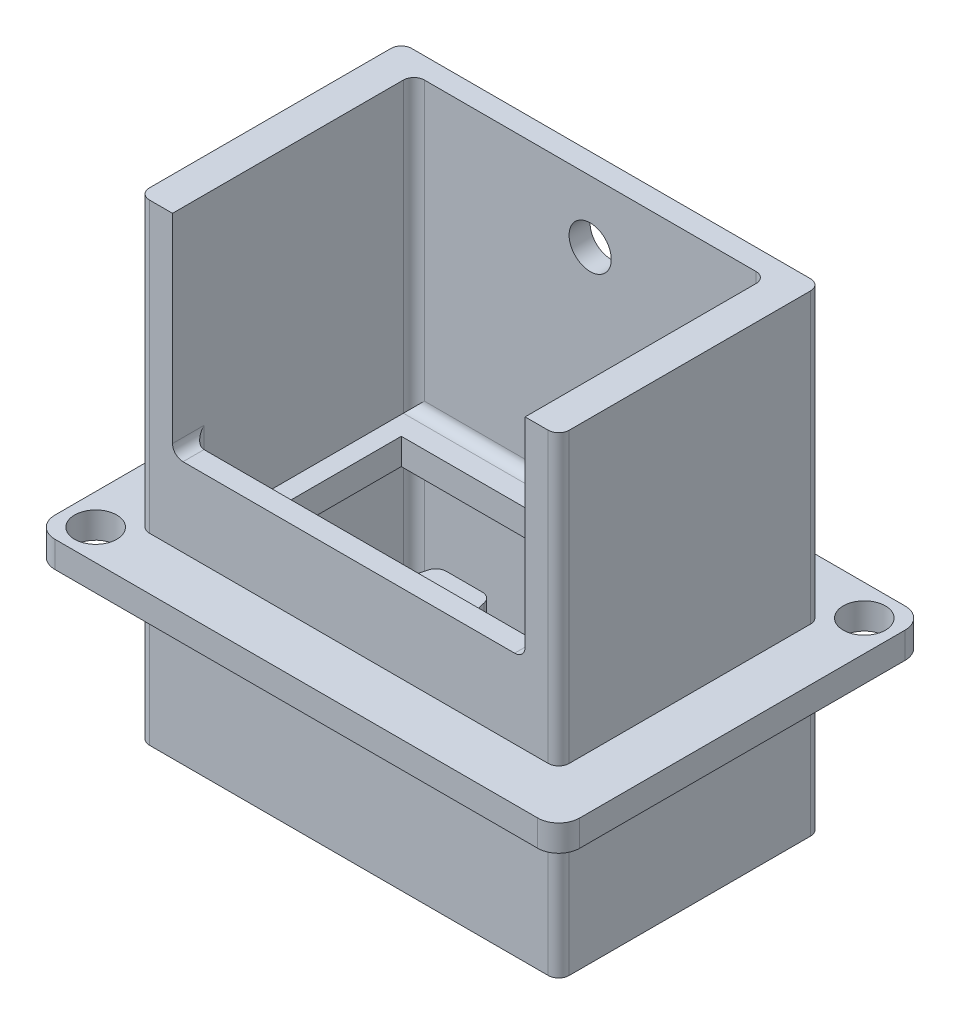
from build123d import *

# Parameters (mm, degrees)
SKETCH1_W                = 63.5
SKETCH1_H                = 44.45
BOSS_EXTRUDE1_DEPTH      = 3.175
FILLET3_R                = 2.54
BOSS_EXTRUDE3_DEPTH      = 19.05
BOSS_EXTRUDE3_DEPTH_BACK = 38.1
SKETCH3_W                = 50.8
SKETCH3_H                = 31.75
SKETCH3_W_2              = 42.672
SKETCH3_H_2              = 26.67
FILLET4_R                = 1.27
SKETCH4_W                = 42.672
SKETCH4_H                = 2.54
CUT_EXTRUDE1_DEPTH       = 25.4
FILLET5_R                = 1.27
FILLET6_R                = 1.27
CUT_EXTRUDE2_REACH       = 64.54
SKETCH5_R                = 2.5527
CUT_EXTRUDE3_REACH       = 56.347
SKETCH6_R                = 2.5527
FILLET7_R                = 1.27


with BuildPart() as part:
    # Sketch1 → Boss-Extrude1 (new body)
    with BuildSketch(Plane(origin=(0, 0, 0), x_dir=(1, 0, 0), z_dir=(0, 1, 0))):
        Rectangle(SKETCH1_W, SKETCH1_H)
        with BuildLine():
            Line((-19.05, -4.014611111), (-19.05, 9.525))
            Line((-19.05, 9.525), (19.05, 9.525))
            Line((19.05, 9.525), (19.05, -4.014611111))
            ThreePointArc((19.05, -4.014611111), (10.305774977, -9.455933485), (3.302, -1.905))
            Line((3.302, -1.905), (-3.302, -1.905))
            ThreePointArc((-3.302, -1.905), (-10.305774977, -9.455933485), (-19.05, -4.014611111))
        make_face(mode=Mode.SUBTRACT)
    extrude(amount=BOSS_EXTRUDE1_DEPTH)

    # Fillet3
    fillet3_edges = [part.edges().sort_by_distance(p)[0] for p in [
        (-31.75, 1.5875, 22.225),
        (-31.75, 1.5875, -22.225),
        (31.75, 1.5875, -22.225),
        (31.75, 1.5875, 22.225),
    ]]
    fillet(fillet3_edges, radius=FILLET3_R)

    # Sketch3 → Boss-Extrude3 (add, two sides: drawn at the far end of the back side and taken through both)
    with BuildSketch(Plane.XZ.offset(-BOSS_EXTRUDE3_DEPTH_BACK)):
        Rectangle(SKETCH3_W, SKETCH3_H)
        Rectangle(SKETCH3_W_2, SKETCH3_H_2, mode=Mode.SUBTRACT)
    extrude(amount=BOSS_EXTRUDE3_DEPTH + BOSS_EXTRUDE3_DEPTH_BACK)

    # Fillet4
    fillet4_edges = [part.edges().sort_by_distance(p)[0] for p in [
        (0, 0, -13.335),
        (21.336, 0, 0),
        (0, 0, 13.335),
        (-21.336, 0, 0),
        (-25.4, -9.525, -15.875),
        (-25.4, -9.525, 15.875),
        (25.4, -9.525, 15.875),
        (25.4, -9.525, -15.875),
        (-21.336, -9.525, 13.335),
        (21.336, -9.525, 13.335),
        (21.336, -9.525, -13.335),
        (-21.336, -9.525, -13.335),
    ]]
    fillet(fillet4_edges, radius=FILLET4_R)

    # Sketch4 → Cut-Extrude1 (cut)
    with BuildSketch(Plane(origin=(0, 38.1, 0), x_dir=(1, 0, 0), z_dir=(0, 1, 0))):
        with Locations((0, -14.605)):
            Rectangle(SKETCH4_W, SKETCH4_H)
    extrude(amount=-CUT_EXTRUDE1_DEPTH, mode=Mode.SUBTRACT)

    # Fillet5
    fillet5_edges = [part.edges().sort_by_distance(p)[0] for p in [
        (21.336, 12.7, 14.605),
        (-21.336, 12.7, 14.605),
        (-3.302, 1.5875, 1.905),
        (3.302, 1.5875, 1.905),
        (0, 3.175, -13.335),
        (21.336, 20.6375, -13.335),
        (-21.336, 20.6375, -13.335),
    ]]
    fillet(fillet5_edges, radius=FILLET5_R)

    # Fillet6
    fillet6_edges = [part.edges().sort_by_distance(p)[0] for p in [
        (0, 3.175, 13.335),
        (-21.336, 8.5725, 13.335),
        (21.336, 8.5725, 13.335),
    ]]
    fillet(fillet6_edges, radius=FILLET6_R)

    # Sketch5 → Cut-Extrude2 (cut, up to next)
    with BuildSketch(Plane(origin=(0, 0, -15.875), x_dir=(-1, 0, 0), z_dir=(0, 0, -1)), mode=Mode.PRIVATE) as cut_extrude2_sk1:
        with Locations((0, 11.557)):
            Circle(SKETCH5_R)
    cut_extrude2_tool1 = extrude(cut_extrude2_sk1.sketch, amount=-CUT_EXTRUDE2_REACH, mode=Mode.PRIVATE) & part.part
    # Sketch5 → Cut-Extrude2 (cut, up to next)
    with BuildSketch(Plane(origin=(0, 0, -15.875), x_dir=(-1, 0, 0), z_dir=(0, 0, -1)), mode=Mode.PRIVATE) as cut_extrude2_sk2:
        with Locations((0, 30.607)):
            Circle(SKETCH5_R)
    cut_extrude2_tool2 = extrude(cut_extrude2_sk2.sketch, amount=-CUT_EXTRUDE2_REACH, mode=Mode.PRIVATE) & part.part
    add(cut_extrude2_tool1.solids().sort_by_distance((0, 11.557, -15.875))[0], mode=Mode.SUBTRACT)
    add(cut_extrude2_tool2.solids().sort_by_distance((0, 30.607, -15.875))[0], mode=Mode.SUBTRACT)

    # Sketch6 → Cut-Extrude3 (cut, up to next)
    with BuildSketch(Plane.XZ, mode=Mode.PRIVATE) as cut_extrude3_sk1:
        with Locations(Location((28.017038418, -18.492038418, 0), (0, 0, 270))):
            Circle(SKETCH6_R)
    cut_extrude3_tool1 = extrude(cut_extrude3_sk1.sketch, amount=-CUT_EXTRUDE3_REACH, mode=Mode.PRIVATE) & part.part
    # Sketch6 → Cut-Extrude3 (cut, up to next)
    with BuildSketch(Plane.XZ, mode=Mode.PRIVATE) as cut_extrude3_sk2:
        with Locations(Location((-28.017038418, 18.492038418, 0), (0, 0, 270))):
            Circle(SKETCH6_R)
    cut_extrude3_tool2 = extrude(cut_extrude3_sk2.sketch, amount=-CUT_EXTRUDE3_REACH, mode=Mode.PRIVATE) & part.part
    add(cut_extrude3_tool1.solids().sort_by_distance((28.017038, 0, -18.492038))[0], mode=Mode.SUBTRACT)
    add(cut_extrude3_tool2.solids().sort_by_distance((-28.017038, 0, 18.492038))[0], mode=Mode.SUBTRACT)

    # Fillet7
    fillet7_edges = [part.edges().sort_by_distance(p)[0] for p in [
        (-25.4, 20.6375, -15.875),
        (-25.4, 20.6375, 15.875),
        (25.4, 20.6375, 15.875),
        (25.4, 20.6375, -15.875),
    ]]
    fillet(fillet7_edges, radius=FILLET7_R)


solid = part.part
